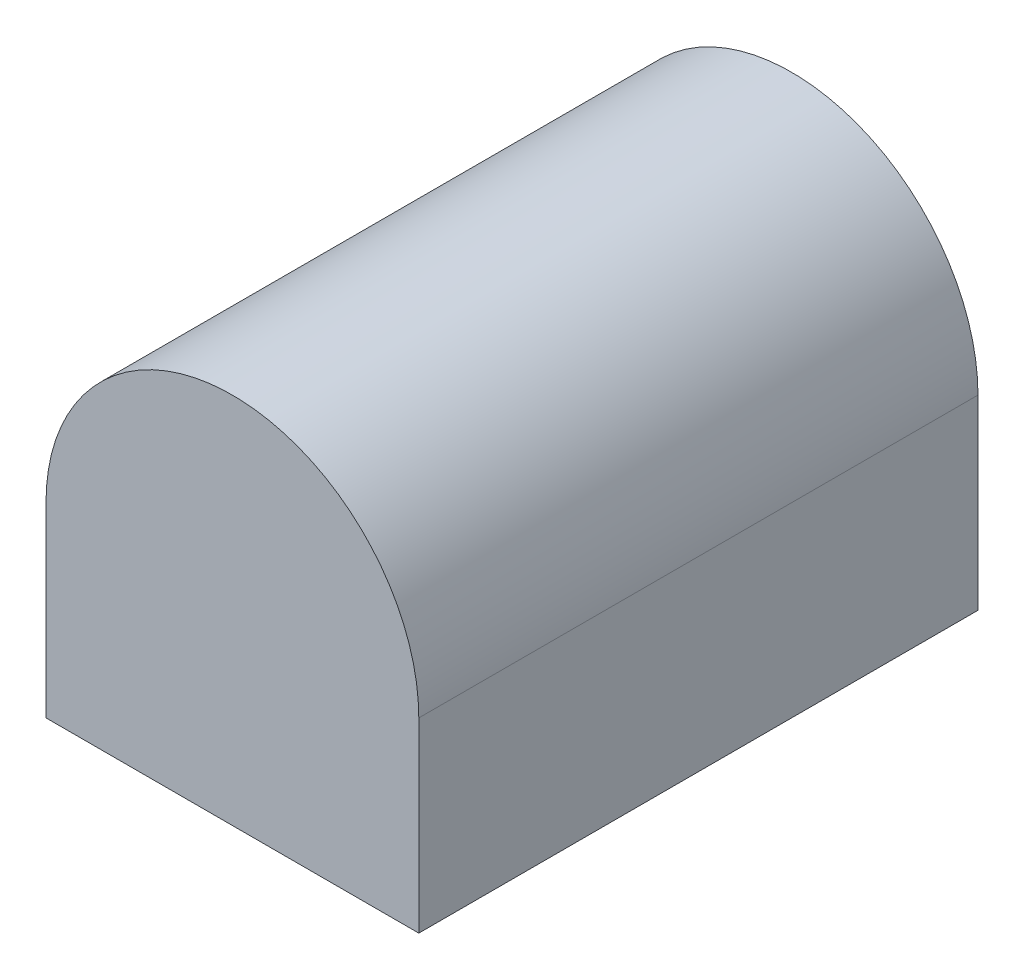
from build123d import *

# Parameters (mm, degrees)
BOSS_EXTRUDE1_DEPTH = 1.5


with BuildPart() as part:
    # Sketch1 → Boss-Extrude1 (new, symmetric)
    with BuildSketch(Plane.XY):
        with BuildLine():
            Line((-1, 0), (1, 0))
            Line((1, 0), (1, 1))
            ThreePointArc((1, 1), (0, 2), (-1, 1))
            Line((-1, 1), (-1, 0))
        make_face()
    extrude(amount=BOSS_EXTRUDE1_DEPTH, both=True)


solid = part.part
